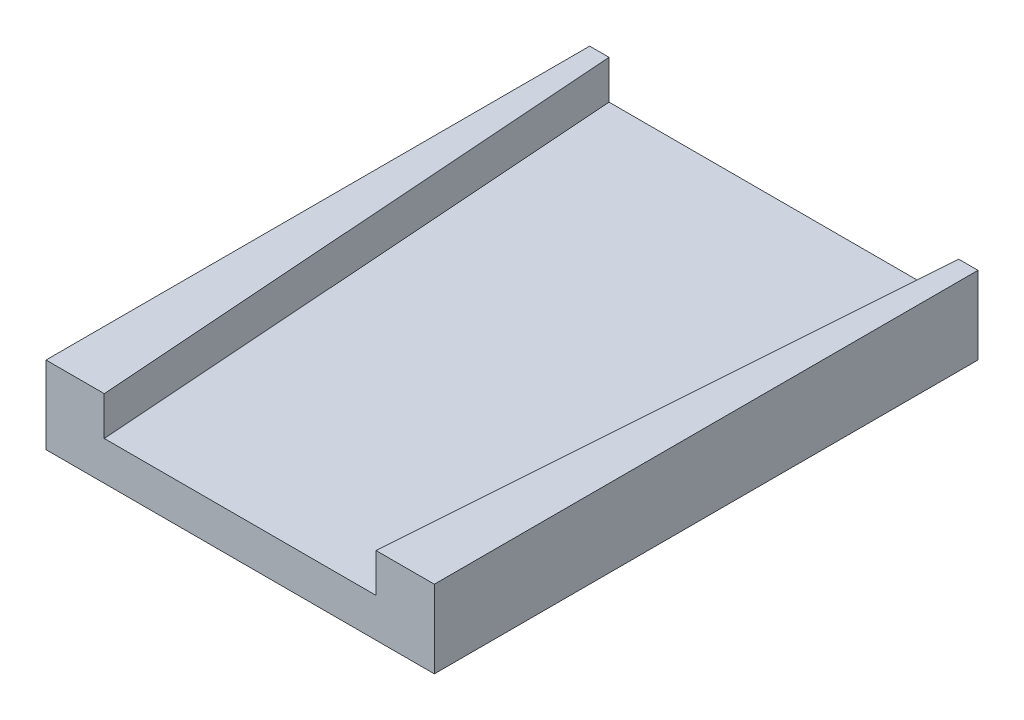
from build123d import *

# Parameters (mm, degrees)
SKETCH1_W           = 127
SKETCH1_H           = 177.8
BOSS_EXTRUDE1_DEPTH = 25.4
CUT_EXTRUDE2_DEPTH  = 12.7


with BuildPart() as part:
    # Sketch1 → Boss-Extrude1 (new body)
    with BuildSketch(Plane(origin=(0, 0, 0), x_dir=(1, 0, 0), z_dir=(0, 1, 0))):
        Rectangle(SKETCH1_W, SKETCH1_H)
    extrude(amount=BOSS_EXTRUDE1_DEPTH)

    # Sketch2 → Cut-Extrude2 (cut)
    with BuildSketch(Plane(origin=(0, 25.4, 0), x_dir=(1, 0, 0), z_dir=(0, 1, 0))):
        Polygon((-57.15, 88.9), (57.15, 88.9), (44.45, -88.9), (-44.45, -88.9), align=None)
    extrude(amount=-CUT_EXTRUDE2_DEPTH, mode=Mode.SUBTRACT)


solid = part.part
